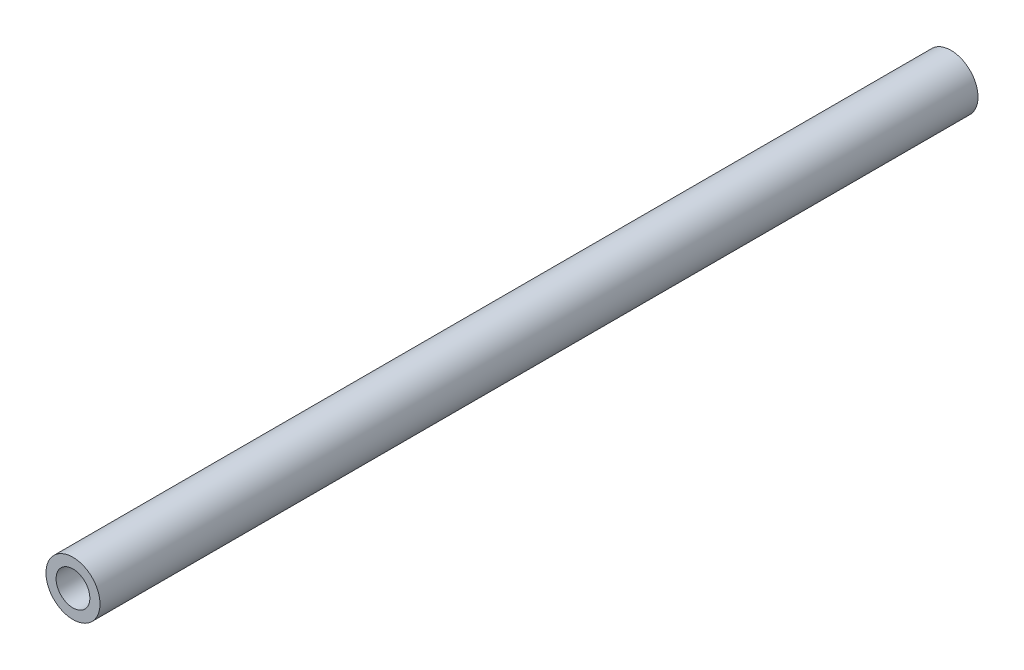
from build123d import *

# Parameters (mm, degrees)
SKETCH2_R           = 4
SKETCH2_R_2         = 2.5
BOSS_EXTRUDE1_DEPTH = 125
BOSS_EXTRUDE2_START = -5
SKETCH2_2_R         = 4
BOSS_EXTRUDE2_DEPTH = 5


with BuildPart() as part:
    # Sketch2 → Boss-Extrude1 (new body)
    with BuildSketch(Plane.XY):
        Circle(SKETCH2_R)
        Circle(SKETCH2_R_2, mode=Mode.SUBTRACT)
    extrude(amount=BOSS_EXTRUDE1_DEPTH)

    # Sketch2<2> → Boss-Extrude2 (add)
    with BuildSketch(Plane.XY.offset(BOSS_EXTRUDE2_START)):
        Circle(SKETCH2_2_R)
    extrude(amount=BOSS_EXTRUDE2_DEPTH)


solid = part.part
